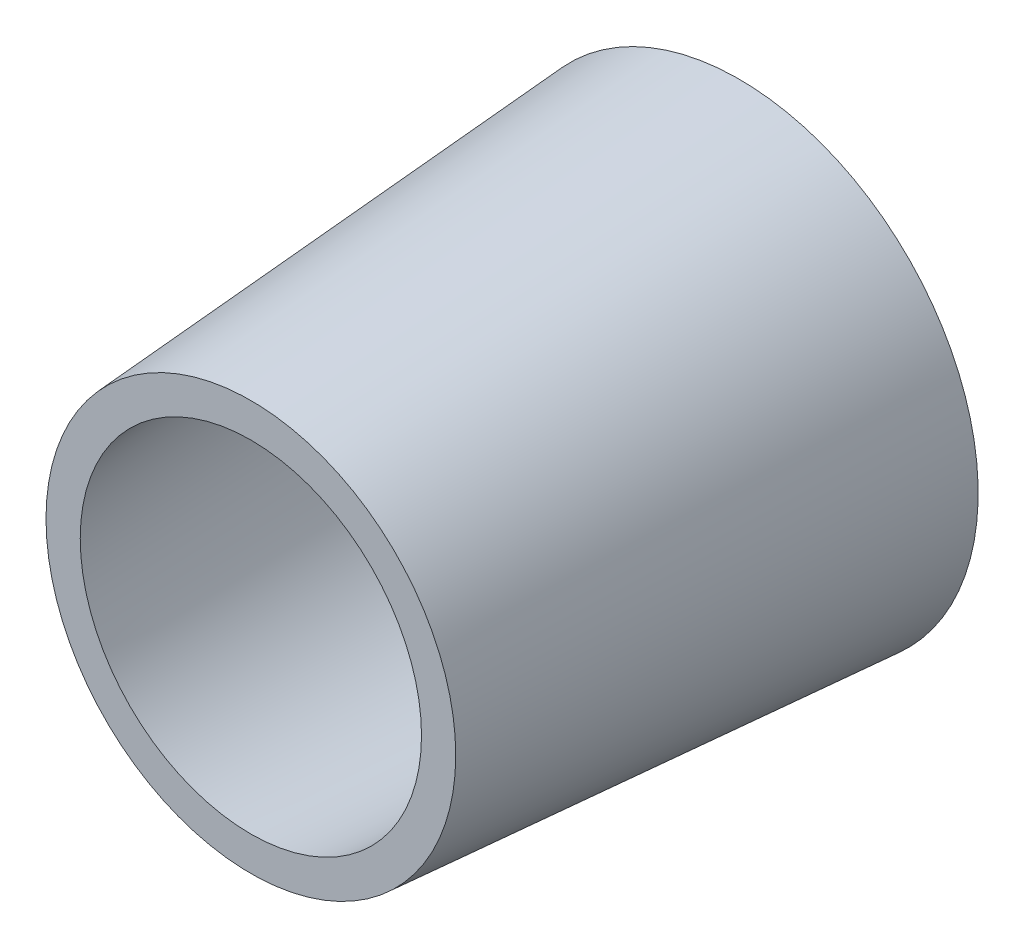
from build123d import *

# Parameters (mm, degrees)
SHELL2_T = -2.54


with BuildPart() as part:
    # Sketch1 → Revolve1 (revolve)
    with BuildSketch(Plane.YZ, mode=Mode.PRIVATE) as revolve1_sk:
        Polygon((0, 0), (0, 36.323692292), (15.24, 36.323692292), (17.78, 0), align=None)
    revolve(revolve1_sk.sketch.rotate(Axis((0, 0, 0), (0, 0, 1)), 90), axis=Axis((0, 0, 0), (0, 0, 1)))

    # Shell2
    shell2_openings = [part.faces().sort_by_distance(p)[0] for p in [
        (0, 0, 36.323692292),
        (0, 0, 0),
    ]]
    offset(amount=SHELL2_T, openings=shell2_openings, kind=Kind.INTERSECTION)


solid = part.part
